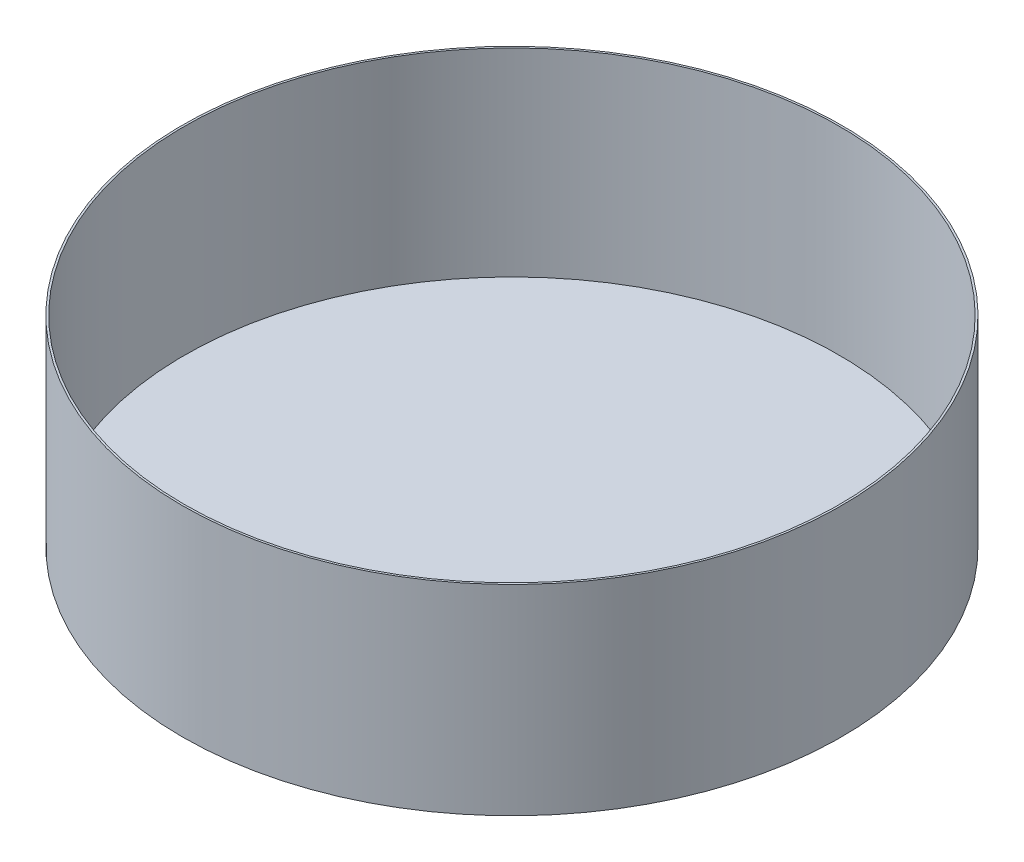
from build123d import *

# Parameters (mm, degrees)
SKETCH1_R           = 41.125
BOSS_EXTRUDE1_DEPTH = 25
SHELL1_T            = -0.25


with BuildPart() as part:
    # Sketch1 → Boss-Extrude1 (new body)
    with BuildSketch(Plane(origin=(0, 0, 0), x_dir=(1, 0, 0), z_dir=(0, 1, 0))):
        with Locations(Location((0, 0, 0), (0, 0, 270))):
            Circle(SKETCH1_R)
    extrude(amount=BOSS_EXTRUDE1_DEPTH)

    # Shell1
    shell1_openings = [part.faces().sort_by_distance(p)[0] for p in [
        (0, 25, 0),
    ]]
    offset(amount=SHELL1_T, openings=shell1_openings, kind=Kind.INTERSECTION)


solid = part.part
